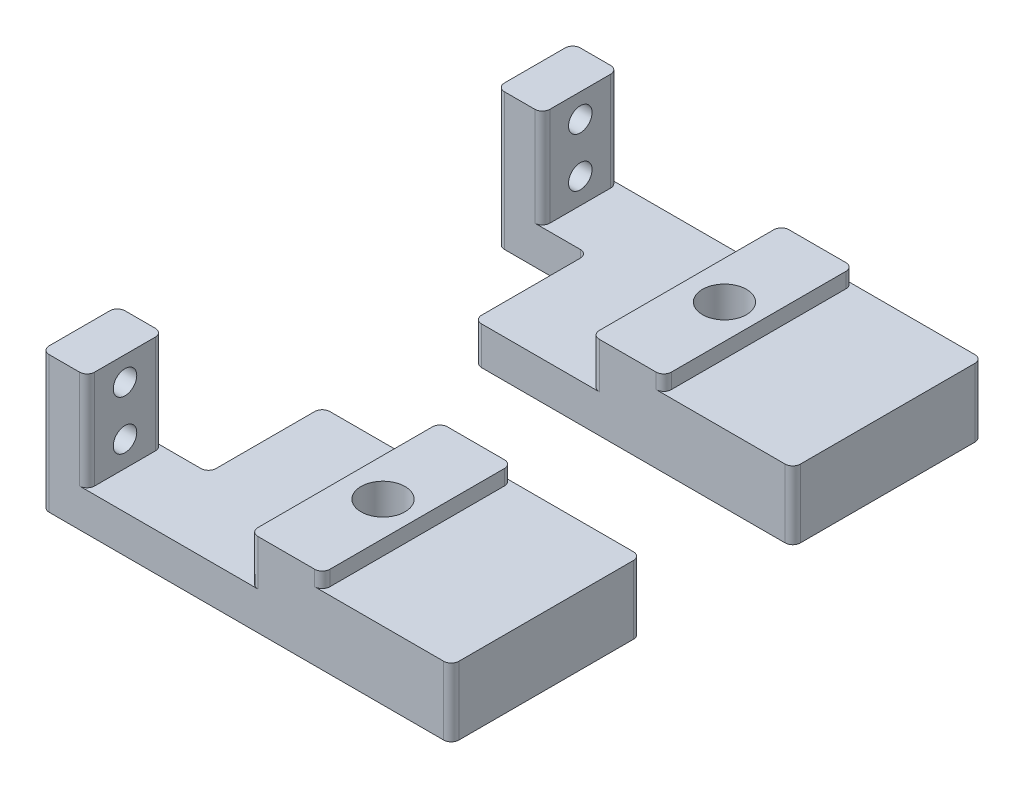
from build123d import *

# Parameters (mm, degrees)
SKETCH1_W                  = 45
SKETCH1_H                  = 25
BOSS_EXTRUDE1_DEPTH        = 5
SKETCH5_W                  = 26.5
SKETCH5_H                  = 25
BOSS_EXTRUDE3_DEPTH        = 4
SKETCH11_W                 = 9.5
SKETCH11_H                 = 25
BOSS_EXTRUDE5_DEPTH        = 2
SKETCH12_W                 = 3
SKETCH12_H                 = 25
CUT_EXTRUDE2_DEPTH         = 52.826634079
M5_CLEARANCE_HOLE1_D       = 5.8
BOSS_EXTRUDE8_DEPTH        = 10
M2_5_CLEARANCE_HOLE1_D     = 3.1
M2_5_CLEARANCE_HOLE1_DEPTH = 6
M2_5_CLEARANCE_HOLE1_TIP   = 0.931333959
FILLET2_R                  = 1


with BuildPart() as part:
    # Sketch1 → Boss-Extrude1 (new body)
    with BuildSketch(Plane(origin=(0, 0, 0), x_dir=(1, 0, 0), z_dir=(0, 1, 0))):
        with Locations((22.5, 12.5)):
            Rectangle(SKETCH1_W, SKETCH1_H)
    extrude(amount=BOSS_EXTRUDE1_DEPTH)

    # Sketch5 → Boss-Extrude3 (add)
    with BuildSketch(Plane(origin=(0, 5, 0), x_dir=(1, 0, 0), z_dir=(0, 1, 0))):
        with Locations((31.75, 12.5)):
            Rectangle(SKETCH5_W, SKETCH5_H)
    extrude(amount=BOSS_EXTRUDE3_DEPTH)

    # Sketch11 → Boss-Extrude5 (add)
    with BuildSketch(Plane(origin=(0, 9, 0), x_dir=(1, 0, 0), z_dir=(0, 1, 0))):
        with Locations((23.25, 12.5)):
            Rectangle(SKETCH11_W, SKETCH11_H)
    extrude(amount=BOSS_EXTRUDE5_DEPTH)

    # Sketch12 → Cut-Extrude2 (cut, through all)
    with BuildSketch(Plane(origin=(0, 5, 0), x_dir=(1, 0, 0), z_dir=(0, 1, 0))):
        with Locations((1.5, 12.5)):
            Rectangle(SKETCH12_W, SKETCH12_H)
    extrude(amount=-CUT_EXTRUDE2_DEPTH, mode=Mode.SUBTRACT)

    # M5 Clearance Hole1 (through all)
    with Locations(Plane(origin=(0, 0, 0), x_dir=(-1, 0, 0), z_dir=(0, -1, 0))):
        with Locations((-23.5, 12.5)):
            Hole(M5_CLEARANCE_HOLE1_D / 2)

    # Sketch18 → Boss-Extrude8 (add)
    with BuildSketch(Plane(origin=(0, 0, -25), x_dir=(-1, 0, 0), z_dir=(0, 0, -1))):
        Polygon((-3, 0), (9, 0), (9, 18), (3, 18), (3, 5), (-3, 5), align=None)
    extrude(amount=-BOSS_EXTRUDE8_DEPTH)

    # M2.5 Clearance Hole1
    with Locations(Plane.ZY.offset(9)):
        with Locations((-20, 14.85), (-20, 8.35)):
            Hole(M2_5_CLEARANCE_HOLE1_D / 2, depth=M2_5_CLEARANCE_HOLE1_DEPTH)
            with Locations((0, 0, -(M2_5_CLEARANCE_HOLE1_DEPTH + M2_5_CLEARANCE_HOLE1_TIP / 2))):  # 118° drill point
                Cone(0, M2_5_CLEARANCE_HOLE1_D / 2, M2_5_CLEARANCE_HOLE1_TIP, mode=Mode.SUBTRACT)

    # Fillet2
    fillet2_edges = [part.edges().sort_by_distance(p)[0] for p in [
        (18.5, 8, -25),
        (18.5, 8, 0),
        (28, 10, 0),
        (28, 10, -25),
        (3, 2.5, 0),
        (3, 2.5, -15),
        (-3, 11.5, -15),
        (-9, 9, -15),
        (-9, 9, -25),
        (-3, 11.5, -25),
        (45, 4.5, -25),
        (45, 4.5, 0),
    ]]
    fillet(fillet2_edges, radius=FILLET2_R)


with BuildPart() as body_2:
    # Mirror2: mirrored copy
    add(part.part.mirror(Plane.XY.offset(10)))


solid = Compound([part.part, body_2.part])
